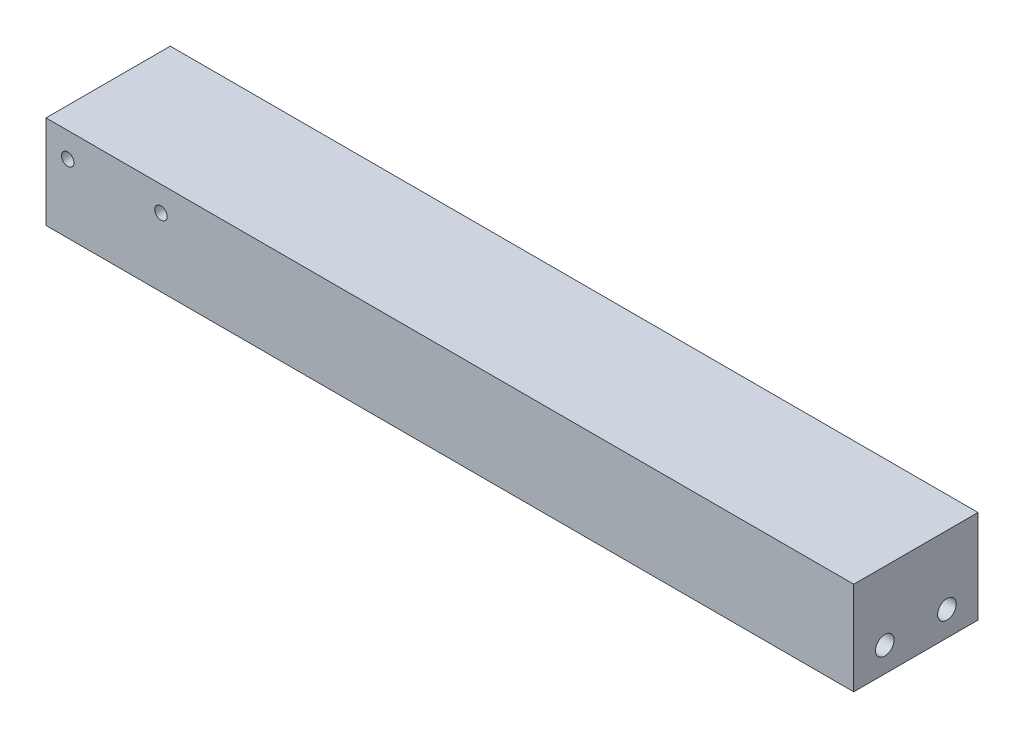
from build123d import *

# Parameters (mm, degrees)
SKETCH1_W               = 260
SKETCH1_H               = 30
BOSS_EXTRUDE1_DEPTH     = 40
ESQUISSE1_R             = 2
ENL_V_MAT_EXTRU_1_DEPTH = 265.764045897
ESQUISSE2_R             = 3
ENL_V_MAT_EXTRU_2_DEPTH = 265.764045897


with BuildPart() as part:
    # Sketch1 → Boss-Extrude1 (new body)
    with BuildSketch(Plane.XY):
        with Locations((130, 15)):
            Rectangle(SKETCH1_W, SKETCH1_H)
    extrude(amount=BOSS_EXTRUDE1_DEPTH)

    # Esquisse1 → Enlèv. mat.-Extru.1 (cut, through all)
    with BuildSketch(Plane.XY.offset(40)):
        with Locations((7, 22)):
            Circle(ESQUISSE1_R)
        with Locations((37, 22)):
            Circle(ESQUISSE1_R)
    extrude(amount=-ENL_V_MAT_EXTRU_1_DEPTH, mode=Mode.SUBTRACT)

    # Esquisse2 → Enlèv. mat.-Extru.2 (cut, through all)
    with BuildSketch(Plane(origin=(260, 0, 0), x_dir=(0, 0, -1), z_dir=(1, 0, 0))):
        with Locations((-10, 8)):
            Circle(ESQUISSE2_R)
        with Locations((-30, 8)):
            Circle(ESQUISSE2_R)
    extrude(amount=-ENL_V_MAT_EXTRU_2_DEPTH, mode=Mode.SUBTRACT)


solid = part.part
